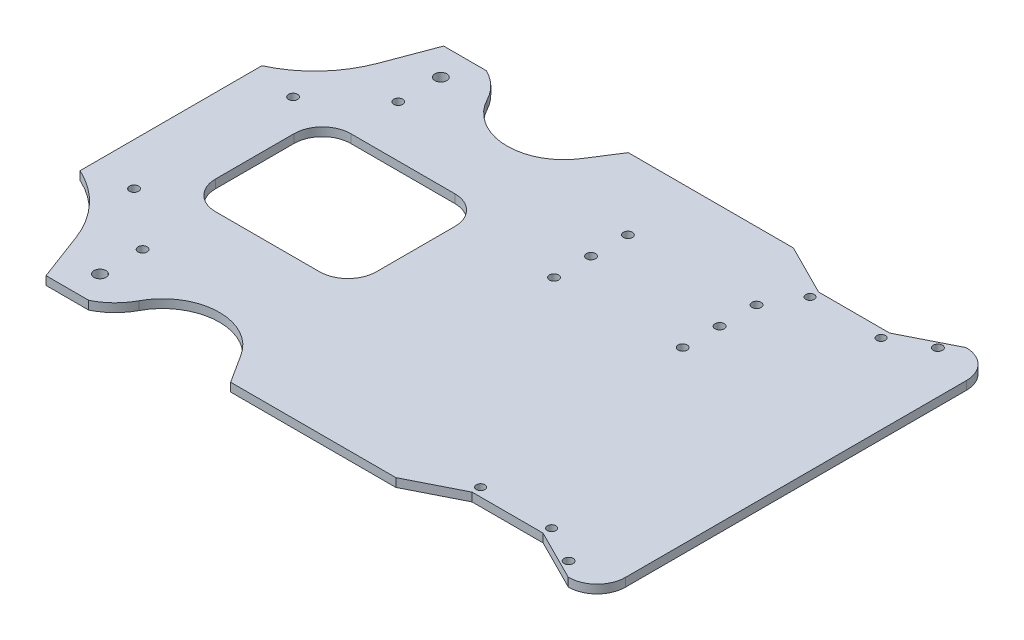
from build123d import *

# Parameters (mm, degrees)
Y_KSEKLIK_EKSTR_ZYON3_DEPTH = 3
KES_EKSTR_ZYON10_DEPTH      = 3
KES_EKSTR_ZYON11_DEPTH      = 3
KES_EKSTR_ZYON14_DEPTH      = 3
KES_EKSTR_ZYON15_DEPTH      = 3
IZIM25_R                    = 1.6
KES_EKSTR_ZYON16_DEPTH      = 10
IZIM33_R                    = 2.1
IZIM33_R_2                  = 1.6
KES_EKSTR_ZYON18_DEPTH      = 3
IZIM34_R                    = 1.6
KES_EKSTR_ZYON19_DEPTH      = 10
KES_EKSTR_ZYON21_DEPTH      = 10
IZIM38_R                    = 1.5
KES_EKSTR_ZYON22_DEPTH      = 10
IZIM39_W                    = 25
IZIM39_H                    = 9
KES_EKSTR_ZYON23_DEPTH      = 10
IZIM40_R                    = 1.6
KES_EKSTR_ZYON24_DEPTH      = 100


with BuildPart() as part:
    # Çizim16 → Yükseklik-Ekstrüzyon3 (new body)
    with BuildSketch(Plane(origin=(0, 0, 0), x_dir=(1, 0, 0), z_dir=(0, 1, 0))):
        with BuildLine():
            Line((-110, -70), (100, -70))
            ThreePointArc((100, -70), (107.071067812, -67.071067812), (110, -60))
            Line((110, -60), (110, 60))
            ThreePointArc((110, 60), (107.071067812, 67.071067812), (100, 70))
            Line((100, 70), (-110, 70))
            Line((-110, 70), (-110, -70))
        make_face()
    extrude(amount=Y_KSEKLIK_EKSTR_ZYON3_DEPTH)

    # Çizim18 → Kes-Ekstrüzyon10 (cut)
    with BuildSketch(Plane(origin=(0, 3, 0), x_dir=(1, 0, 0), z_dir=(0, 1, 0))):
        with BuildLine():
            Line((-19, 70), (-25.463821511, 59.889658192))
            ThreePointArc((-25.463821511, 59.889658192), (-43.144058736, 50.67991016), (-60, 61.323569832))
            ThreePointArc((-60, 61.323569832), (-63.804672609, 66.383043129), (-69, 70))
            Line((-69, 70), (-19, 70))
        make_face()
    extrude(amount=-KES_EKSTR_ZYON10_DEPTH, mode=Mode.SUBTRACT)

    # Çizim19 → Kes-Ekstrüzyon11 (cut)
    with BuildSketch(Plane(origin=(0, 3, 0), x_dir=(1, 0, 0), z_dir=(0, 1, 0))):
        with BuildLine():
            Line((-19, -70), (-25.463821511, -59.889658192))
            ThreePointArc((-25.463821511, -59.889658192), (-43.144058736, -50.67991016), (-60, -61.323569832))
            ThreePointArc((-60, -61.323569832), (-63.804672609, -66.383043129), (-69, -70))
            Line((-69, -70), (-19, -70))
        make_face()
    extrude(amount=-KES_EKSTR_ZYON11_DEPTH, mode=Mode.SUBTRACT)

    # Çizim23 → Kes-Ekstrüzyon14 (cut)
    with BuildSketch(Plane(origin=(0, 3, 0), x_dir=(1, 0, 0), z_dir=(0, 1, 0))):
        with BuildLine():
            Line((-84, -70), (-90.329717397, -53.149638649))
            ThreePointArc((-90.329717397, -53.149638649), (-98.077113424, -40.633105793), (-110, -32))
            Line((-110, -32), (-110, -70))
            Line((-110, -70), (-84, -70))
        make_face()
    extrude(amount=-KES_EKSTR_ZYON14_DEPTH, mode=Mode.SUBTRACT)

    # Çizim24 → Kes-Ekstrüzyon15 (cut)
    with BuildSketch(Plane(origin=(0, 3, 0), x_dir=(1, 0, 0), z_dir=(0, 1, 0))):
        with BuildLine():
            Line((-84, 70), (-90.329717397, 53.149638649))
            ThreePointArc((-90.329717397, 53.149638649), (-98.077113424, 40.633105793), (-110, 32))
            Line((-110, 32), (-110, 70))
            Line((-110, 70), (-84, 70))
        make_face()
    extrude(amount=-KES_EKSTR_ZYON15_DEPTH, mode=Mode.SUBTRACT)

    # Çizim25 → Kes-Ekstrüzyon16 (cut)
    with BuildSketch(Plane(origin=(0, 3, 0), x_dir=(1, 0, 0), z_dir=(0, 1, 0))):
        with Locations(Location((-95, 28, 0), (0, 0, 270))):
            Circle(IZIM25_R)
        with Locations(Location((-95, -28, 0), (0, 0, 270))):
            Circle(IZIM25_R)
    extrude(amount=-KES_EKSTR_ZYON16_DEPTH, mode=Mode.SUBTRACT)

    # Çizim33 → Kes-Ekstrüzyon18 (cut)
    with BuildSketch(Plane(origin=(0, 3, 0), x_dir=(1, 0, 0), z_dir=(0, 1, 0))):
        with Locations(Location((-75, -60, 0), (0, 0, 270))):
            Circle(IZIM33_R)
        with Locations(Location((-75, 60, 0), (0, 0, 270))):
            Circle(IZIM33_R)
        with Locations(Location((-75, 45, 0), (0, 0, 270))):
            Circle(IZIM33_R_2)
        with Locations(Location((-75, -45, 0), (0, 0, 270))):
            Circle(IZIM33_R_2)
    extrude(amount=-KES_EKSTR_ZYON18_DEPTH, mode=Mode.SUBTRACT)

    # Çizim34 → Kes-Ekstrüzyon19 (cut)
    with BuildSketch(Plane(origin=(0, 3, 0), x_dir=(1, 0, 0), z_dir=(0, 1, 0))):
        with Locations(Location((95, -65, 0), (0, 0, 270))):
            Circle(IZIM34_R)
        with Locations(Location((95, 65, 0), (0, 0, 270))):
            Circle(IZIM34_R)
    extrude(amount=-KES_EKSTR_ZYON19_DEPTH, mode=Mode.SUBTRACT)

    # Çizim37 → Kes-Ekstrüzyon21 (cut)
    with BuildSketch(Plane(origin=(0, 3, 0), x_dir=(1, 0, 0), z_dir=(0, 1, 0))):
        with BuildLine():
            Line((-73.628967409, -20.666004446), (-37.018589471, -20.666004446))
            ThreePointArc((-37.018589471, -20.666004446), (-29.947521659, -17.737072258), (-27.018589471, -10.666004446))
            Line((-27.018589471, -10.666004446), (-27.018589471, 16.938177002))
            ThreePointArc((-27.018589471, 16.938177002), (-29.947521659, 24.009244814), (-37.018589471, 26.938177002))
            Line((-37.018589471, 26.938177002), (-73.628967409, 26.938177002))
            ThreePointArc((-73.628967409, 26.938177002), (-80.700035221, 24.009244814), (-83.628967409, 16.938177002))
            Line((-83.628967409, 16.938177002), (-83.628967409, -10.666004446))
            ThreePointArc((-83.628967409, -10.666004446), (-80.700035221, -17.737072258), (-73.628967409, -20.666004446))
        make_face()
    extrude(amount=-KES_EKSTR_ZYON21_DEPTH, mode=Mode.SUBTRACT)

    # Çizim38 → Kes-Ekstrüzyon22 (cut)
    with BuildSketch(Plane(origin=(0, 3, 0), x_dir=(1, 0, 0), z_dir=(0, 1, 0))):
        with Locations(Location((57, -58, 0), (0, 0, 270))):
            Circle(IZIM38_R)
        with Locations(Location((82, -58, 0), (0, 0, 270))):
            Circle(IZIM38_R)
        with Locations(Location((57, 58, 0), (0, 0, 270))):
            Circle(IZIM38_R)
        with Locations(Location((82, 58, 0), (0, 0, 270))):
            Circle(IZIM38_R)
    extrude(amount=-KES_EKSTR_ZYON22_DEPTH, mode=Mode.SUBTRACT)

    # Çizim39 → Kes-Ekstrüzyon23 (cut)
    with BuildSketch(Plane(origin=(0, 3, 0), x_dir=(1, 0, 0), z_dir=(0, 1, 0))):
        with Locations((69.5, -65.5)):
            Rectangle(IZIM39_W, IZIM39_H)
        Polygon((57, -70), (57, -61), (39.139428901, -70), align=None)
        Polygon((99.860571099, -70), (82, -61), (82, -70), align=None)
        Polygon((57, 61), (57, 70), (39.139428901, 70), align=None)
        with Locations((69.5, 65.5)):
            Rectangle(IZIM39_W, IZIM39_H)
        Polygon((99.860571099, 70), (82, 70), (82, 61), align=None)
    extrude(amount=-KES_EKSTR_ZYON23_DEPTH, mode=Mode.SUBTRACT)

    # Çizim40 → Kes-Ekstrüzyon24 (cut)
    with BuildSketch(Plane(origin=(0, 3, 0), x_dir=(-1, 0, 0), z_dir=(0, 1, 0))):
        with Locations(Location((-6, -44.857008165, 0), (0, 0, 90))):
            Circle(IZIM40_R)
        with Locations(Location((-50, -46.144414684, 0), (0, 0, 90))):
            Circle(IZIM40_R)
        with Locations(Location((-50, -33.144414684, 0), (0, 0, 90))):
            Circle(IZIM40_R)
        with Locations(Location((-6, -31.857008165, 0), (0, 0, 90))):
            Circle(IZIM40_R)
        with Locations(Location((-50, -20.144414684, 0), (0, 0, 90))):
            Circle(IZIM40_R)
        with Locations(Location((-6, -18.857008165, 0), (0, 0, 90))):
            Circle(IZIM40_R)
    extrude(amount=-KES_EKSTR_ZYON24_DEPTH, mode=Mode.SUBTRACT)


solid = part.part
